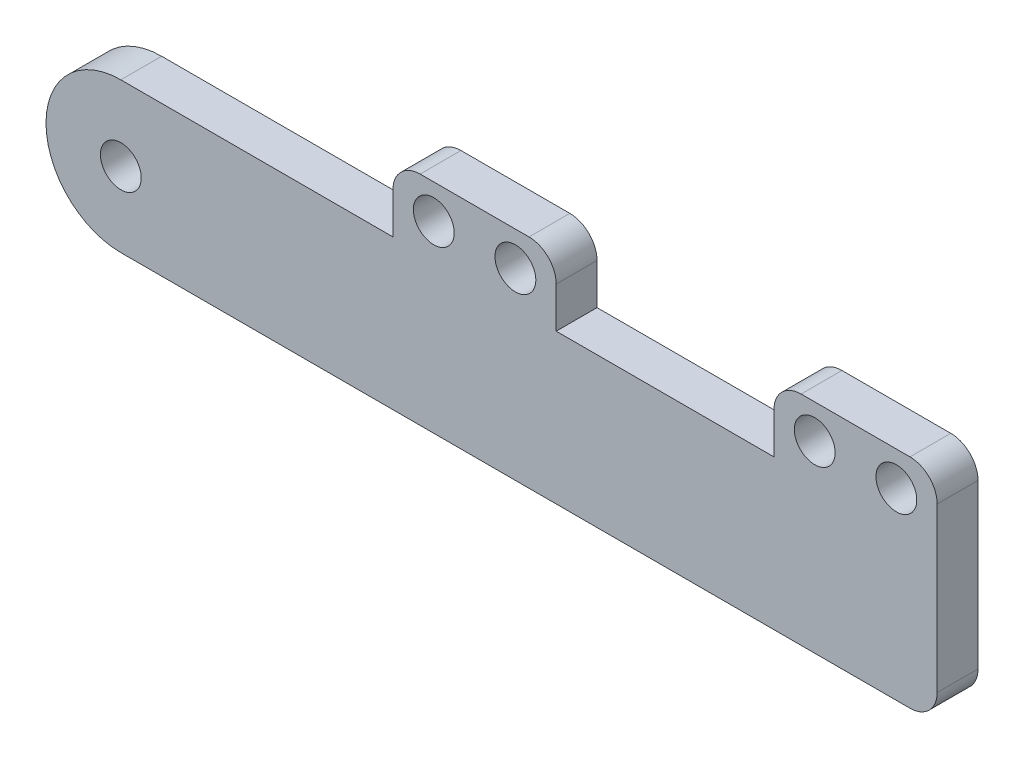
from build123d import *

# Parameters (mm, degrees)
ESQUISSE1_R             = 1.5
BOSS_EXTRU_1_DEPTH      = 3
ESQUISSE2_R             = 1.5
ENL_V_MAT_EXTRU_1_DEPTH = 50.779679597
CONG_1_R                = 2


with BuildPart() as part:
    # Esquisse1 → Boss.-Extru.1 (new body)
    with BuildSketch(Plane.XY):
        with BuildLine():
            Line((-22.956336023, 0), (-22.956336023, 5))
            Line((-22.956336023, 5), (-10.956336023, 5))
            Line((-10.956336023, 5), (-10.956336023, 0))
            Line((-10.956336023, 0), (5.043663977, 0))
            Line((5.043663977, 0), (5.043663977, 5))
            Line((5.043663977, 5), (17.043663977, 5))
            Line((17.043663977, 5), (17.043663977, -11))
            Line((17.043663977, -11), (-42.956336023, -11))
            ThreePointArc((-42.956336023, -11), (-48.456336023, -5.5), (-42.956336023, 0))
            Line((-42.956336023, 0), (-22.956336023, 0))
        make_face()
        with Locations((-19.956336023, 2.5)):
            Circle(ESQUISSE1_R, mode=Mode.SUBTRACT)
        with Locations(Location((-13.956336023, 2.5, 0), (0, 0, 180))):
            Circle(ESQUISSE1_R, mode=Mode.SUBTRACT)
        with Locations((8.043663977, 2.5)):
            Circle(ESQUISSE1_R, mode=Mode.SUBTRACT)
        with Locations(Location((14.043663977, 2.5, 0), (0, 0, 180))):
            Circle(ESQUISSE1_R, mode=Mode.SUBTRACT)
    extrude(amount=BOSS_EXTRU_1_DEPTH)

    # Esquisse2 → Enlèv. mat.-Extru.1 (cut, through all)
    with BuildSketch(Plane.XY.offset(3)):
        with Locations((-42.956336023, -5.5)):
            Circle(ESQUISSE2_R)
    extrude(amount=-ENL_V_MAT_EXTRU_1_DEPTH, mode=Mode.SUBTRACT)

    # Congé1
    cong_1_edges = [part.edges().sort_by_distance(p)[0] for p in [
        (-22.956336023, 5, 1.5),
        (-10.956336023, 5, 1.5),
        (5.043663977, 5, 1.5),
        (17.043663977, 5, 1.5),
        (17.043663977, -11, 1.5),
    ]]
    fillet(cong_1_edges, radius=CONG_1_R)


solid = part.part
